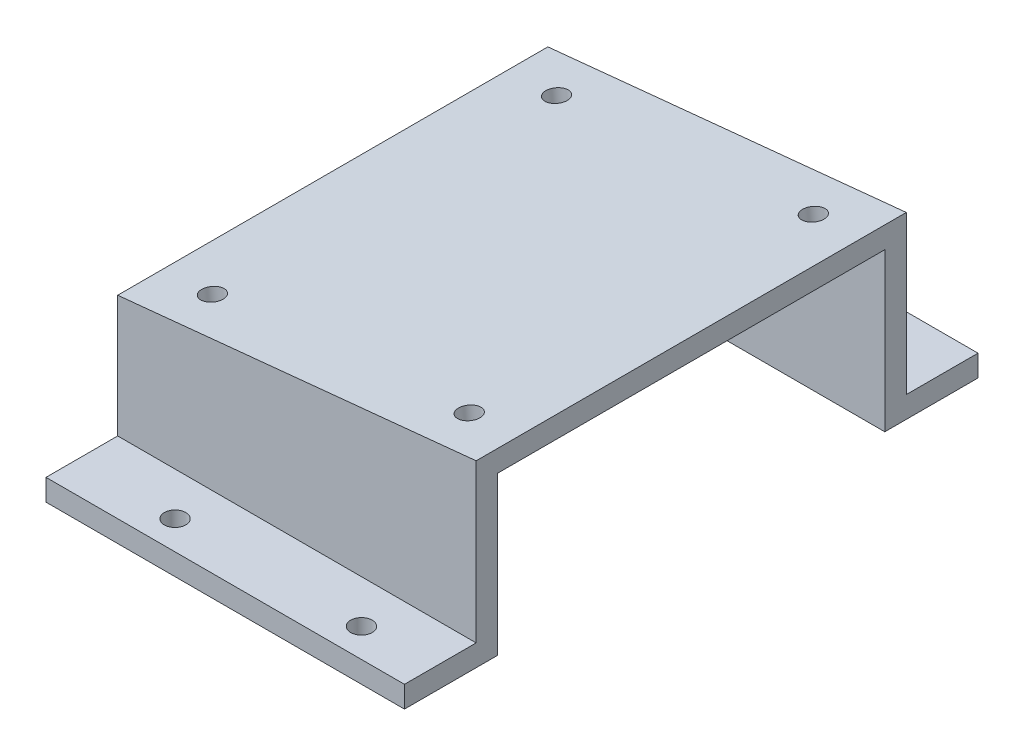
from build123d import *

# Parameters (mm, degrees)
EXTRUDE_3_DEPTH     = 3
EXTRUDE_4_DEPTH     = 54
EXTRUDE_5_DEPTH     = 3
SKETCH_9_W          = 50
SKETCH_9_H          = 3
EXTRUDE_6_DEPTH     = 10
SKETCH_10_W         = 50
SKETCH_10_H         = 3
EXTRUDE_7_DEPTH     = 10
SKETCH_11_R         = 1.5
CUT_EXTRUDE_1_DEPTH = 7
SKETCH_12_R         = 1.5
CUT_EXTRUDE_2_DEPTH = 7


with BuildPart() as part:
    # 草图4 → 凸台-拉伸3 (new body)
    with BuildSketch(Plane.XY):
        Polygon((0, 0), (50, 0), (50, 25), (0, 20), align=None)
    extrude(amount=EXTRUDE_3_DEPTH)

    # 草图5 → 凸台-拉伸4 (add)
    with BuildSketch(Plane.XY.offset(3)):
        Polygon((0, 20), (0, 17), (50, 22), (50, 25), align=None)
    extrude(amount=EXTRUDE_4_DEPTH)

    # 草图8 → 凸台-拉伸5 (add)
    with BuildSketch(Plane.XY.offset(57)):
        Polygon((0, 20), (50, 25), (50, 0), (0, 0), align=None)
    extrude(amount=EXTRUDE_5_DEPTH)

    # 草图9 → 凸台-拉伸6 (add)
    with BuildSketch(Plane.XY.offset(60)):
        with Locations((25, 1.5)):
            Rectangle(SKETCH_9_W, SKETCH_9_H)
    extrude(amount=EXTRUDE_6_DEPTH)

    # 草图10 → 凸台-拉伸7 (add)
    with BuildSketch(Plane(origin=(0, 0, 0), x_dir=(-1, 0, 0), z_dir=(0, 0, -1))):
        with Locations((-25, 1.5)):
            Rectangle(SKETCH_10_W, SKETCH_10_H)
    extrude(amount=EXTRUDE_7_DEPTH)

    # 草图11 → 切除-拉伸1 (cut)
    with BuildSketch(Plane(origin=(0, 3, 0), x_dir=(1, 0, 0), z_dir=(0, 1, 0))):
        with Locations(Location((14, -66, 0), (0, 0, 270))):
            Circle(SKETCH_11_R)
        with Locations(Location((40, -66, 0), (0, 0, 270))):
            Circle(SKETCH_11_R)
        with Locations(Location((40, 6, 0), (0, 0, 270))):
            Circle(SKETCH_11_R)
        with Locations(Location((14, 6, 0), (0, 0, 270))):
            Circle(SKETCH_11_R)
    extrude(amount=-CUT_EXTRUDE_1_DEPTH, mode=Mode.SUBTRACT)

    # 草图12 → 切除-拉伸2 (cut)
    with BuildSketch(Plane(origin=(-1.98019802, 19.801980198, 0), x_dir=(0.9950371902099892, 0.09950371902099896, 0), z_dir=(-0.09950371902099897, 0.9950371902099893, 0))):
        with Locations(Location((45.239452486, -6, 0), (0, 0, 180))):
            Circle(SKETCH_12_R)
        with Locations(Location((45.239452486, -54, 0), (0, 0, 180))):
            Circle(SKETCH_12_R)
        with Locations(Location((9.239452486, -54, 0), (0, 0, 180))):
            Circle(SKETCH_12_R)
        with Locations(Location((9.239452486, -6, 0), (0, 0, 180))):
            Circle(SKETCH_12_R)
    extrude(amount=-CUT_EXTRUDE_2_DEPTH, mode=Mode.SUBTRACT)


solid = part.part
